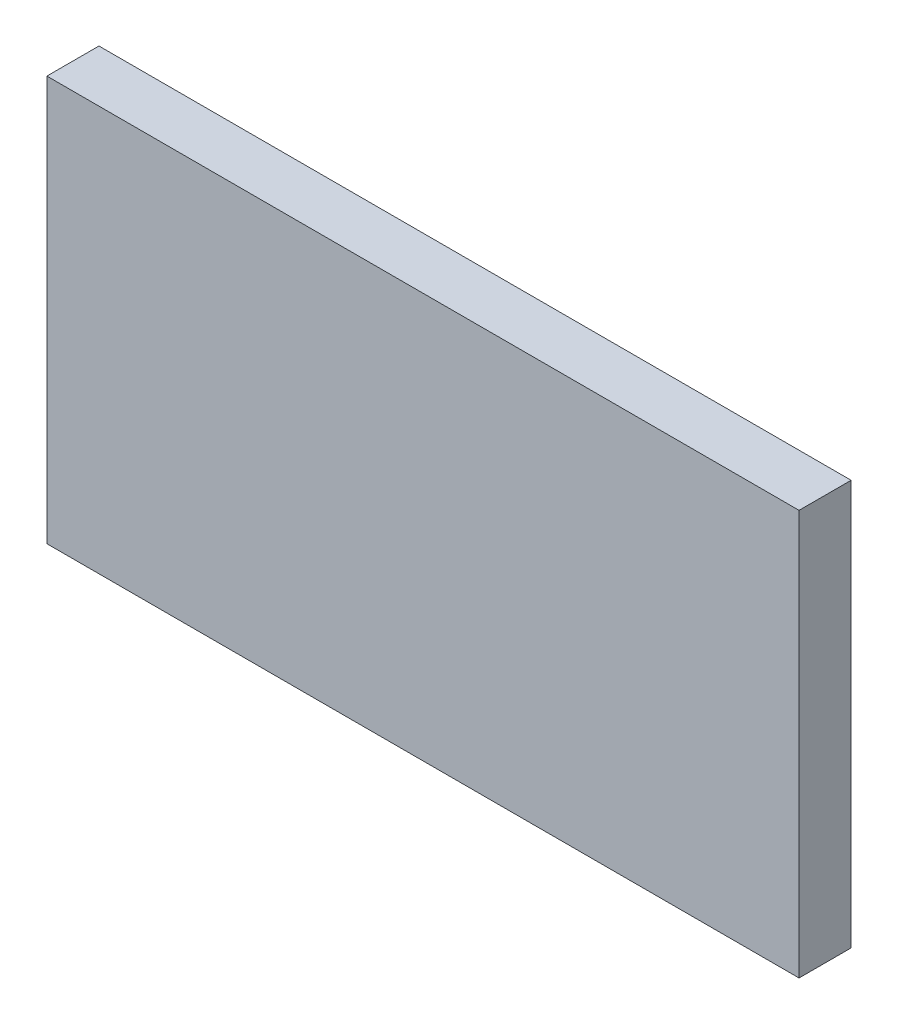
from build123d import *

# Parameters (mm, degrees)
SKETCH1_W           = 130
SKETCH1_H           = 70
BOSS_EXTRUDE1_DEPTH = 9


with BuildPart() as part:
    # Sketch1 → Boss-Extrude1 (new body)
    with BuildSketch(Plane.XY):
        with Locations((-14.347408829, 36.871401152)):
            Rectangle(SKETCH1_W, SKETCH1_H)
    extrude(amount=BOSS_EXTRUDE1_DEPTH)


solid = part.part
